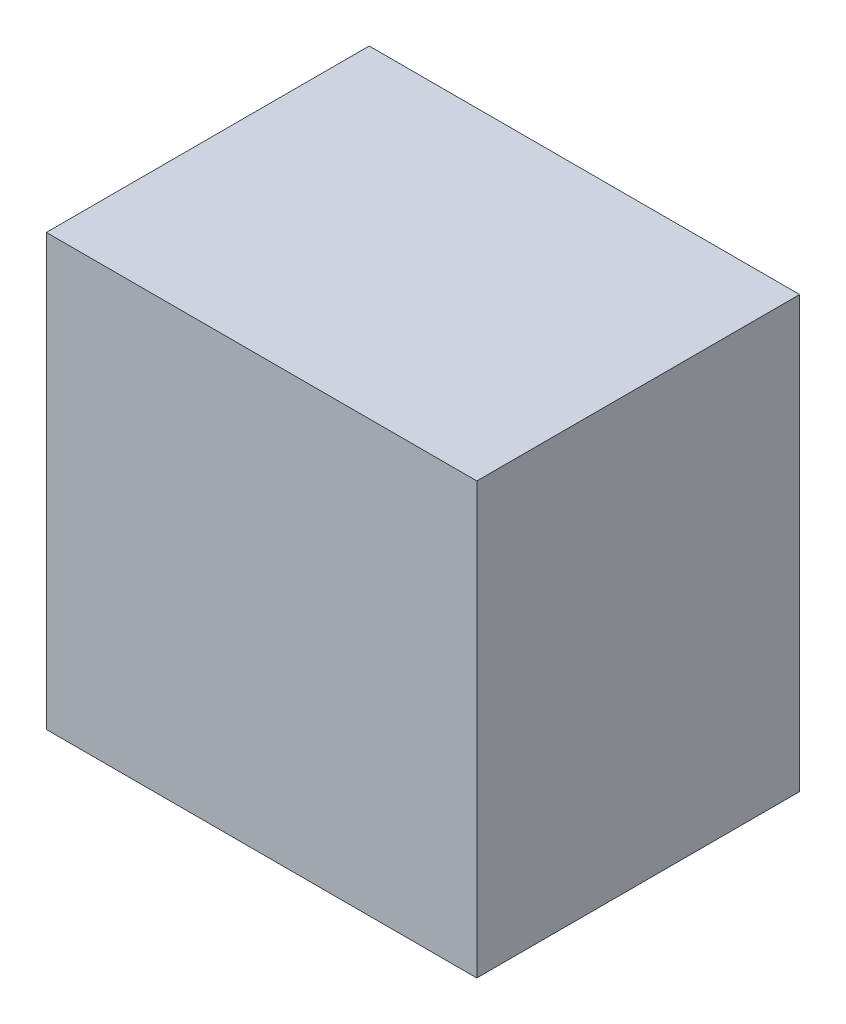
from build123d import *

# Parameters (mm, degrees)
SKETCH1_W           = 50.8
SKETCH1_H           = 50.8
BOSS_EXTRUDE1_DEPTH = 38.1


with BuildPart() as part:
    # Sketch1 → Boss-Extrude1 (new body)
    with BuildSketch(Plane.XY):
        Rectangle(SKETCH1_W, SKETCH1_H)
    extrude(amount=BOSS_EXTRUDE1_DEPTH)


solid = part.part
